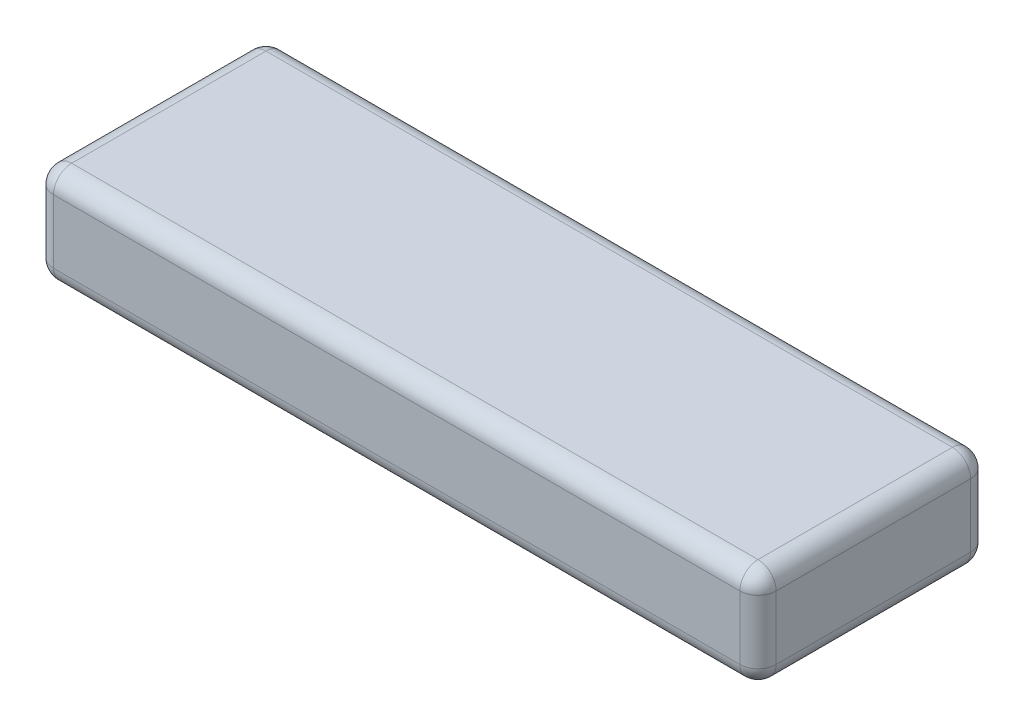
from build123d import *

# Parameters (mm, degrees)
SKETCH1_W           = 59.69
SKETCH1_H           = 19.05
BOSS_EXTRUDE1_DEPTH = 8.255
FILLET1_R           = 1.5


with BuildPart() as part:
    # Sketch1 → Boss-Extrude1 (new body)
    with BuildSketch(Plane(origin=(0, 0, 0), x_dir=(1, 0, 0), z_dir=(0, 1, 0))):
        Rectangle(SKETCH1_W, SKETCH1_H)
    extrude(amount=BOSS_EXTRUDE1_DEPTH)

    # Fillet1
    fillet1_edges = [part.edges().sort_by_distance(p)[0] for p in [
        (-29.845, 8.255, 0),
        (0, 8.255, 9.525),
        (29.845, 8.255, 0),
        (0, 0, 9.525),
        (-29.845, 0, 0),
        (0, 0, -9.525),
        (29.845, 0, 0),
        (29.845, 4.1275, 9.525),
        (-29.845, 4.1275, 9.525),
        (-29.845, 4.1275, -9.525),
        (29.845, 4.1275, -9.525),
        (0, 8.255, -9.525),
    ]]
    fillet(fillet1_edges, radius=FILLET1_R)


solid = part.part
